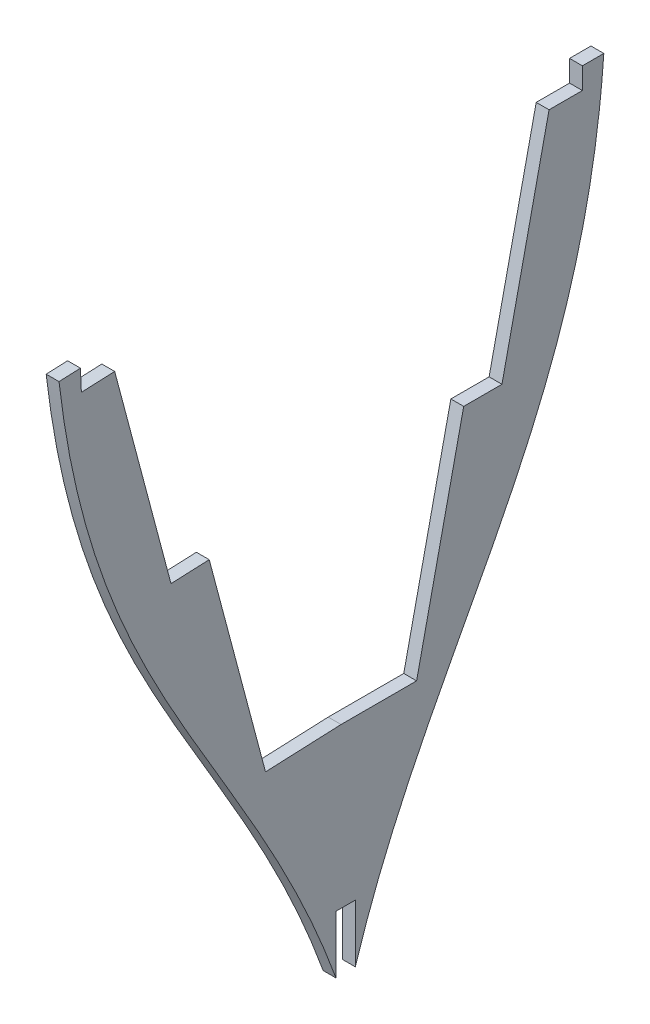
from build123d import *

# Parameters (mm, degrees)
BOSS_EXTRU_3_DEPTH      = 6
ENL_V_MAT_EXTRU_1_DEPTH = 10


with BuildPart() as part:
    # Esquisse2 → Boss.-Extru.3 (new body)
    with BuildSketch(Plane(origin=(0, 0, 0), x_dir=(0, 0, -1), z_dir=(1, 0, 0))):
        with BuildLine():
            Line((119.711610695, 366.039005154), (109.711610695, 366.039005154))
            Line((109.711610695, 366.039005154), (109.711610695, 356.039005154))
            Line((109.711610695, 356.039005154), (94.138082152, 356.039005154))
            Line((94.138082152, 356.039005154), (72.155634041, 256.039005154))
            Line((72.155634041, 256.039005154), (54.28830069, 256.039005154))
            Line((54.28830069, 256.039005154), (32.305852578, 156.039005154))
            Line((32.305852578, 156.039005154), (-2.982638809, 156.039005154))
            Line((-2.982638809, 156.039005154), (-38.238065612, 154.511750988))
            Line((-38.238065612, 154.511750988), (-64.527826677, 253.466672484))
            Line((-64.527826677, 253.466672484), (-82.378418708, 252.693390368))
            Line((-82.378418708, 252.693390368), (-108.668179773, 351.648311863))
            Line((-108.668179773, 351.648311863), (-124.227116243, 350.974303556))
            Line((-124.227116243, 350.974303556), (-124.659907248, 360.964933764))
            Line((-124.659907248, 360.964933764), (-134.650537455, 360.532142759))
            add(Edge.make_bspline(
                [(-134.650537455, 360.532142759), (-117.788106266, 213.336232223), (-40.120308472, 162.829698053), (-0.484204579, 40.636249064)],
                knots=[0, 0, 0, 0, 1, 1, 1, 1], degree=3))
            add(Edge.make_bspline(
                [(119.711610695, 366.039005154), (109.23548586, 218.251223276), (33.826338548, 164.430620253), (-0.484204579, 40.636249064)],
                knots=[0, 0, 0, 0, 1, 1, 1, 1], degree=3))
        make_face()
    extrude(amount=BOSS_EXTRU_3_DEPTH)

    # Esquisse3 → Enlèv. mat.-Extru.1 (cut)
    with BuildSketch(Plane(origin=(6, 0, 0), x_dir=(0, 0, -1), z_dir=(1, 0, 0))):
        Polygon((-5.321814798, 54.705223034), (-5.321814798, 81.705223034), (3.678185202, 81.705223034), (3.678185202, 54.705223034), (9.336488724, 34.218680036), (-20.702093174, 34.218680036), align=None)
    extrude(amount=-ENL_V_MAT_EXTRU_1_DEPTH, mode=Mode.SUBTRACT)


solid = part.part
